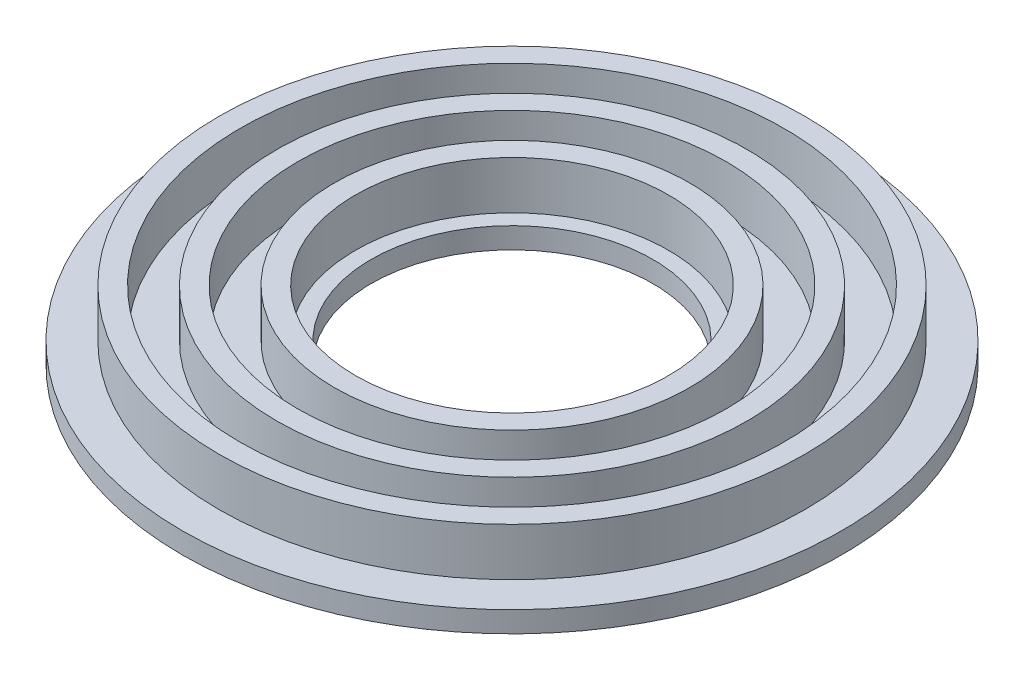
from build123d import *

# Parameters (mm, degrees)
CROQUIS1_R     = 11
EXTRUIR1_DEPTH = 0.7
CROQUIS2_R     = 9.775
CROQUIS2_R_2   = 9.075
CROQUIS2_R_3   = 7.85
CROQUIS2_R_4   = 7.15
CROQUIS2_R_5   = 5.925
CROQUIS2_R_6   = 5.225
EXTRUIR2_DEPTH = 1.6
CROQUIS3_R     = 4.7
EXTRUIR3_DEPTH = 1.6


with BuildPart() as part:
    # Croquis1 → Extruir1 (new body)
    with BuildSketch(Plane(origin=(0, 0, 0), x_dir=(1, 0, 0), z_dir=(0, 1, 0))):
        with Locations(Location((0, 0, 0), (0, 0, 270))):
            Circle(CROQUIS1_R)
    extrude(amount=EXTRUIR1_DEPTH)

    # Croquis2 → Extruir2 (add)
    # profile 1 of 3: a face of its own
    with BuildSketch(Plane(origin=(0, 0.7, 0), x_dir=(1, 0, 0), z_dir=(0, 1, 0))):
        with Locations(Location((0, 0, 0), (0, 0, 270))):
            Circle(CROQUIS2_R)
        with Locations(Location((0, 0, 0), (0, 0, 270))):
            Circle(CROQUIS2_R_2, mode=Mode.SUBTRACT)
    # profile 2 of 3: a face of its own
    with BuildSketch(Plane(origin=(0, 0.7, 0), x_dir=(1, 0, 0), z_dir=(0, 1, 0))):
        with Locations(Location((0, 0, 0), (0, 0, 270))):
            Circle(CROQUIS2_R_3)
        with Locations(Location((0, 0, 0), (0, 0, 270))):
            Circle(CROQUIS2_R_4, mode=Mode.SUBTRACT)
    # profile 3 of 3: a face of its own
    with BuildSketch(Plane(origin=(0, 0.7, 0), x_dir=(1, 0, 0), z_dir=(0, 1, 0))):
        with Locations(Location((0, 0, 0), (0, 0, 270))):
            Circle(CROQUIS2_R_5)
        with Locations(Location((0, 0, 0), (0, 0, 270))):
            Circle(CROQUIS2_R_6, mode=Mode.SUBTRACT)
    extrude(amount=EXTRUIR2_DEPTH)

    # Croquis3 → Extruir3 (cut)
    with BuildSketch(Plane(origin=(0, 0.7, 0), x_dir=(1, 0, 0), z_dir=(0, 1, 0))):
        with Locations(Location((0, 0, 0), (0, 0, 270))):
            Circle(CROQUIS3_R)
    extrude(amount=-EXTRUIR3_DEPTH, mode=Mode.SUBTRACT)


solid = part.part
